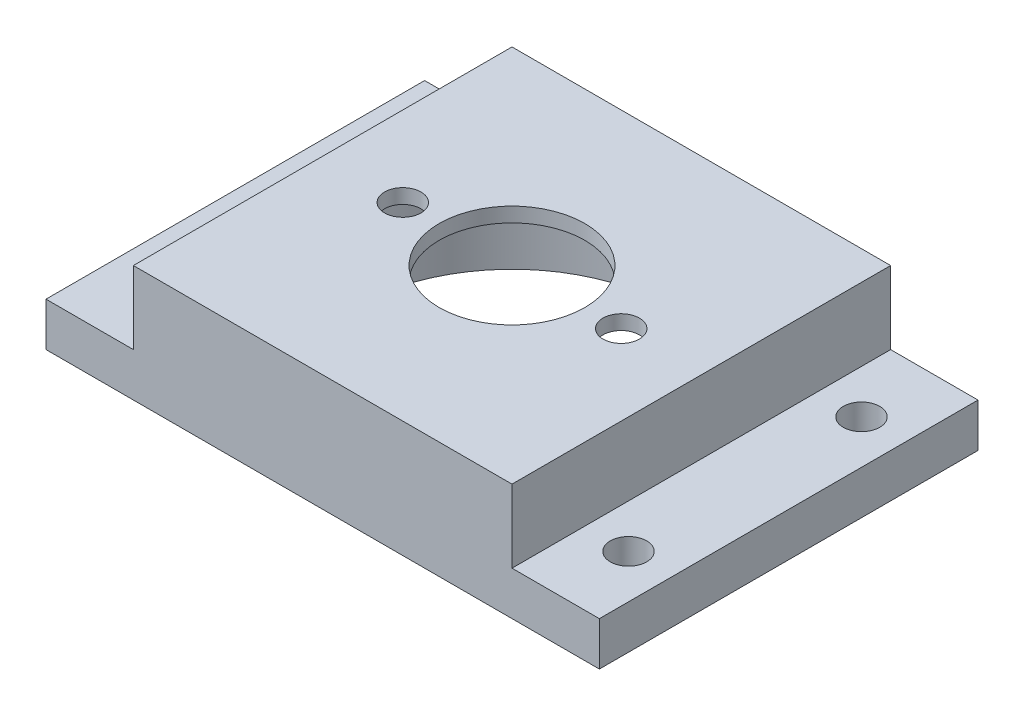
from build123d import *

# Parameters (mm, degrees)
BOSS_EXTRUDE1_DEPTH = 26
SKETCH2_R           = 5
SKETCH2_R_2         = 1.25
CUT_EXTRUDE1_DEPTH  = 47.733285782
SKETCH3_R           = 11
CUT_EXTRUDE2_DEPTH  = 7
SKETCH5_R           = 1
CUT_EXTRUDE7_DEPTH  = 6


with BuildPart() as part:
    # Sketch1 → Boss-Extrude1 (new body)
    with BuildSketch(Plane.XY):
        Polygon((0, 0), (8, 0), (30, 0), (38, 0), (38, 3), (32, 3), (32, 8), (6, 8), (6, 3), (0, 3), align=None)
    extrude(amount=BOSS_EXTRUDE1_DEPTH)

    # Sketch2 → Cut-Extrude1 (cut, through all)
    with BuildSketch(Plane(origin=(0, 8, 0), x_dir=(1, 0, 0), z_dir=(0, 1, 0))):
        with Locations(Location((19, -13, 0), (0, 0, 180))):
            Circle(SKETCH2_R)
        with Locations(Location((11.5, -13, 0), (0, 0, 180))):
            Circle(SKETCH2_R_2)
        with Locations(Location((26.5, -13, 0), (0, 0, 180))):
            Circle(SKETCH2_R_2)
        with Locations(Location((3, -21, 0), (0, 0, 180))):
            Circle(SKETCH2_R_2)
        with Locations(Location((3, -5, 0), (0, 0, 180))):
            Circle(SKETCH2_R_2)
        with Locations(Location((35, -21, 0), (0, 0, 180))):
            Circle(SKETCH2_R_2)
        with Locations(Location((35, -5, 0), (0, 0, 180))):
            Circle(SKETCH2_R_2)
    extrude(amount=-CUT_EXTRUDE1_DEPTH, mode=Mode.SUBTRACT)

    # Sketch3 → Cut-Extrude2 (cut)
    with BuildSketch(Plane.XZ):
        with Locations(Location((19, 13, 0), (0, 0, 270))):
            Circle(SKETCH3_R)
    extrude(amount=-CUT_EXTRUDE2_DEPTH, mode=Mode.SUBTRACT)

    # Sketch5 → Cut-Extrude7 (cut)
    with BuildSketch(Plane(origin=(0, 0, 0), x_dir=(-1, 0, 0), z_dir=(0, 0, -1))):
        with Locations((-29, 2.5)):
            Circle(SKETCH5_R)
        with Locations((-9, 2.5)):
            Circle(SKETCH5_R)
    extrude(amount=-CUT_EXTRUDE7_DEPTH, mode=Mode.SUBTRACT)


solid = part.part
